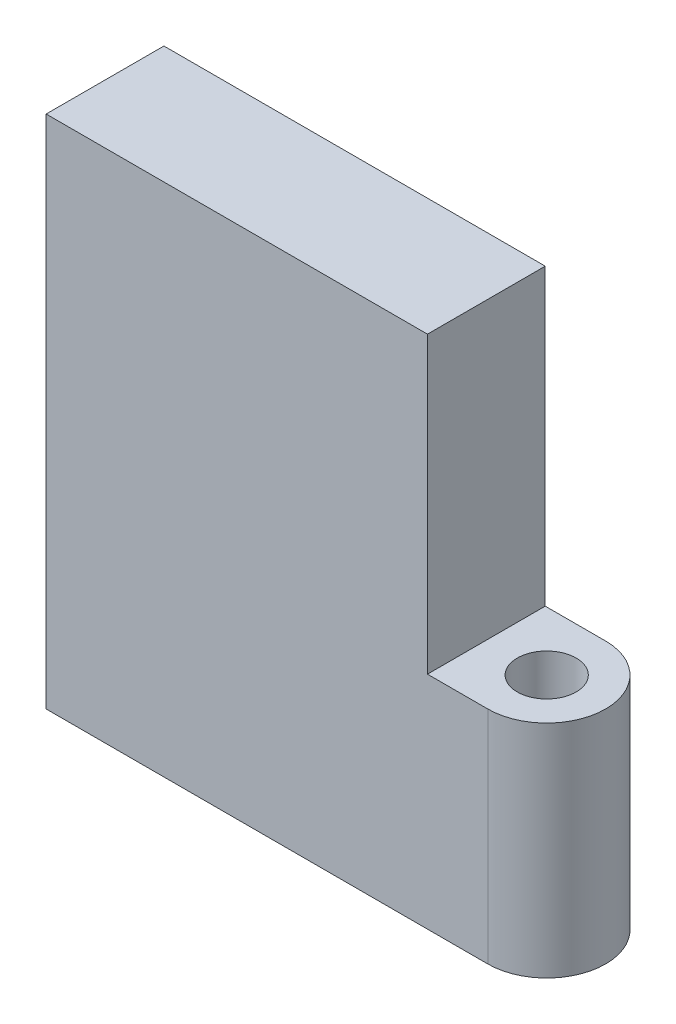
from build123d import *

# Parameters (mm, degrees)
BOSS_EXTRUDE1_DEPTH = 15
SKETCH3_R           = 2
CUT_EXTRUDE1_DEPTH  = 12.5
SKETCH4_W           = 25.9
SKETCH4_H           = 8
BOSS_EXTRUDE2_DEPTH = 20


with BuildPart() as part:
    # Sketch2 → Boss-Extrude1 (new body)
    with BuildSketch(Plane(origin=(0, 0, 0), x_dir=(1, 0, 0), z_dir=(0, 1, 0))):
        with BuildLine():
            Line((-30, -4), (0, -4))
            ThreePointArc((0, -4), (-4, 0), (0, 4))
            Line((0, 4), (-30, 4))
            Line((-30, 4), (-30, -4))
        make_face()
        with BuildLine():
            ThreePointArc((0, 4), (-4, 0), (0, -4))
            Line((0, -4), (0, 4))
        make_face()
        with BuildLine():
            Line((0, 4), (0, -4))
            ThreePointArc((0, -4), (2.828427125, -2.828427125), (4, 0))
            ThreePointArc((4, 0), (2.828427125, 2.828427125), (0, 4))
        make_face()
    extrude(amount=BOSS_EXTRUDE1_DEPTH)

    # Sketch3 → Cut-Extrude1 (cut)
    with BuildSketch(Plane(origin=(0, 15, 0), x_dir=(1, 0, 0), z_dir=(0, 1, 0))):
        with Locations(Location((0, 0, 0), (0, 0, 270))):
            Circle(SKETCH3_R)
    extrude(amount=-CUT_EXTRUDE1_DEPTH, mode=Mode.SUBTRACT)

    # Sketch4 → Boss-Extrude2 (add)
    with BuildSketch(Plane(origin=(0, 15, 0), x_dir=(1, 0, 0), z_dir=(0, 1, 0))):
        with Locations((-17.05, 0)):
            Rectangle(SKETCH4_W, SKETCH4_H)
    extrude(amount=BOSS_EXTRUDE2_DEPTH)


solid = part.part
